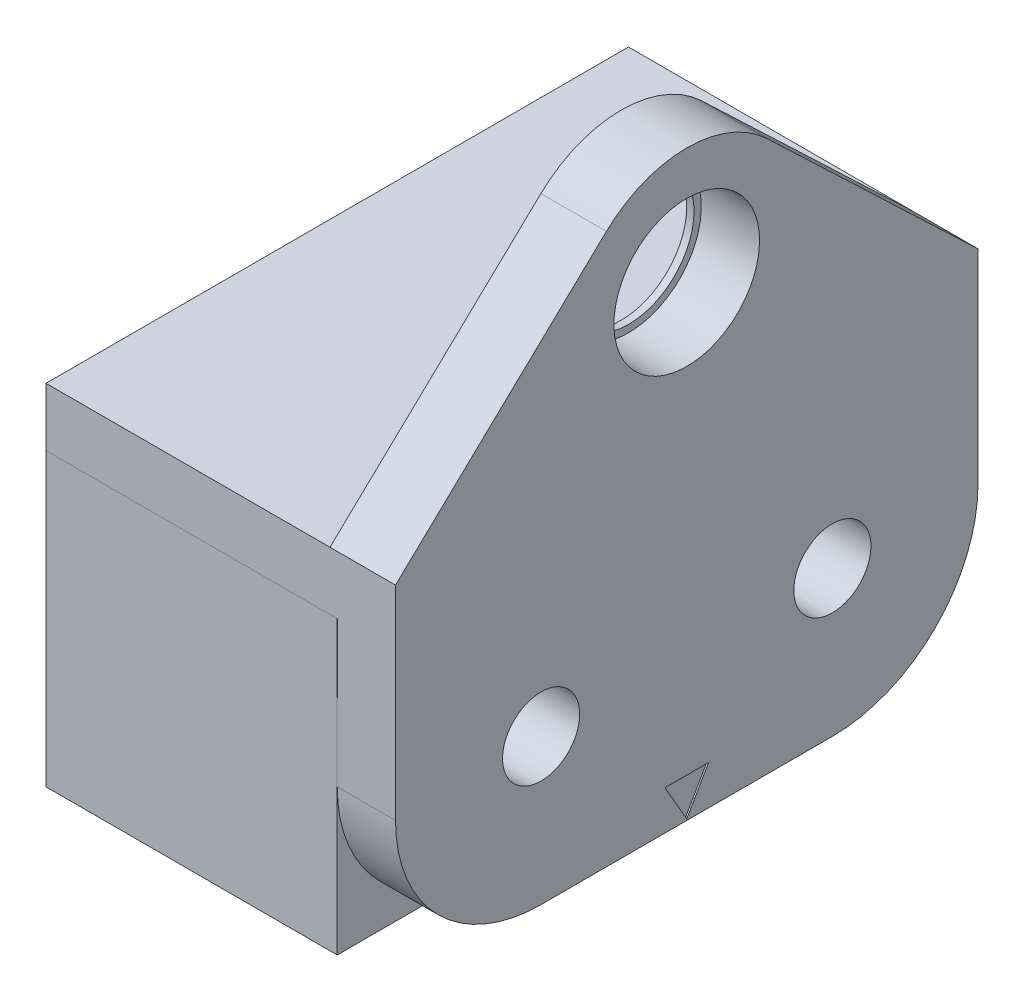
from build123d import *

# Parameters (mm, degrees)
SKETCH_2_W                 = 20
SKETCH_2_H                 = 20
EXTRUDE_1_DEPTH            = 20
SKETCH_3_W                 = 40
SKETCH_3_H                 = 24
EXTRUDE_2_DEPTH            = 4
SKETCH_5_W                 = 2.65
SKETCH_5_H                 = 24
HOLE_WIZARD_M51_AT_2_COUNT = 2
HOLE_WIZARD_M51_AT_2_PITCH = 20
SKETCH_6_W                 = 40
SKETCH_6_H                 = 4
EXTRUDE_3_DEPTH            = 20
SKETCH_7_W                 = 6.1
SKETCH_7_H                 = 8
EXTRUDE_4_DEPTH            = 3
CHAMFER_1_SIZE             = 1
SKETCH_8_R                 = 5
EXTRUDE_5_DEPTH            = 4.5
SKETCH_9_R                 = 5
SKETCH_9_R_2               = 4.5
EXTRUDE_6_DEPTH            = 0.5
FILLET_1_R                 = 10
CUT_EXTRUDE_2_DEPTH        = 0.1


with BuildPart() as part:
    # Эскиз2 → Бобышка-Вытянуть1 (new, symmetric)
    with BuildSketch(Plane.XY):
        Rectangle(SKETCH_2_W, SKETCH_2_H)
    extrude(amount=EXTRUDE_1_DEPTH, both=True)


with BuildPart() as body_2:
    # Эскиз3 → Бобышка-Вытянуть2 (new body)
    with BuildSketch(Plane(origin=(10, 0, 0), x_dir=(0, 0, -1), z_dir=(1, 0, 0))):
        with Locations((0, 2)):
            Rectangle(SKETCH_3_W, SKETCH_3_H)
    extrude(amount=EXTRUDE_2_DEPTH)

    # Эскиз5 → Отверстие с зазором M51 (revolve, cut)
    with BuildSketch(Plane(origin=(14, 0, 10), x_dir=(0, 0, -1), z_dir=(0, 1, 0))):
        with Locations((1.325, 12)):
            Rectangle(SKETCH_5_W, SKETCH_5_H)
    hole_wizard_m51 = revolve(axis=Axis((20.35, 0, 10), (-1, 0, 0)), mode=Mode.SUBTRACT)

    # Отверстие с зазором M51 at 2: Отверстие с зазором M51 ×2
    with Locations(*[(0, 0, -i * HOLE_WIZARD_M51_AT_2_PITCH) for i in range(1, HOLE_WIZARD_M51_AT_2_COUNT)]):
        add(hole_wizard_m51, mode=Mode.SUBTRACT)

    # Эскиз6 → Бобышка-Вытянуть3 (add)
    with BuildSketch(Plane.ZY.offset(-10)):
        with Locations((0, 12)):
            Rectangle(SKETCH_6_W, SKETCH_6_H)
    extrude(amount=EXTRUDE_3_DEPTH)

    # Эскиз7 → Бобышка-Вытянуть4 (add)
    with BuildSketch(Plane.XZ.offset(-10)):
        with Locations((0, 12)):
            Rectangle(SKETCH_7_W, SKETCH_7_H)
        with Locations((0, -12)):
            Rectangle(SKETCH_7_W, SKETCH_7_H)
    extrude(amount=EXTRUDE_4_DEPTH)

    # Фаска1
    chamfer_1_edges = [body_2.edges().sort_by_distance(p)[0] for p in [
        (-3.05, 7, 12),
        (3.05, 7, 12),
        (-3.05, 7, -12),
        (3.05, 7, -12),
    ]]
    chamfer(chamfer_1_edges, length=CHAMFER_1_SIZE)

    # Эскиз8 → Бобышка-Вытянуть5 (add)
    with BuildSketch(Plane(origin=(14, 0, 0), x_dir=(0, 0, -1), z_dir=(1, 0, 0))):
        with BuildLine():
            ThreePointArc((-5.517241379, 27.793103448), (0, 30), (5.517241379, 27.793103448))
            Line((5.517241379, 27.793103448), (20, 14))
            Line((20, 14), (-20, 14))
            Line((-20, 14), (-5.517241379, 27.793103448))
        make_face()
        with Locations(Location((0, 22, 0), (0, 0, 90))):
            Circle(SKETCH_8_R, mode=Mode.SUBTRACT)
    extrude(amount=-EXTRUDE_5_DEPTH)

    # Эскиз9 → Бобышка-Вытянуть6 (add)
    with BuildSketch(Plane.ZY.offset(-9.5)):
        with Locations(Location((0, 22, 0), (0, 0, 90))):
            Circle(SKETCH_9_R)
        with Locations(Location((0, 22, 0), (0, 0, 270))):
            Circle(SKETCH_9_R_2, mode=Mode.SUBTRACT)
    extrude(amount=-EXTRUDE_6_DEPTH)

    # Скругление1
    fillet_1_edges = [body_2.edges().sort_by_distance(p)[0] for p in [
        (12, -10, -20),
        (12, -10, 20),
    ]]
    fillet(fillet_1_edges, radius=FILLET_1_R)

    # Эскиз10 → Вырез-Вытянуть2 (cut)
    with BuildSketch(Plane(origin=(14, 0, 0), x_dir=(0, 0, -1), z_dir=(1, 0, 0))):
        Polygon((0, -9.9), (1.5, -7.301923789), (-1.5, -7.301923789), align=None)
    extrude(amount=-CUT_EXTRUDE_2_DEPTH, mode=Mode.SUBTRACT)


solid = Compound([part.part, body_2.part])
